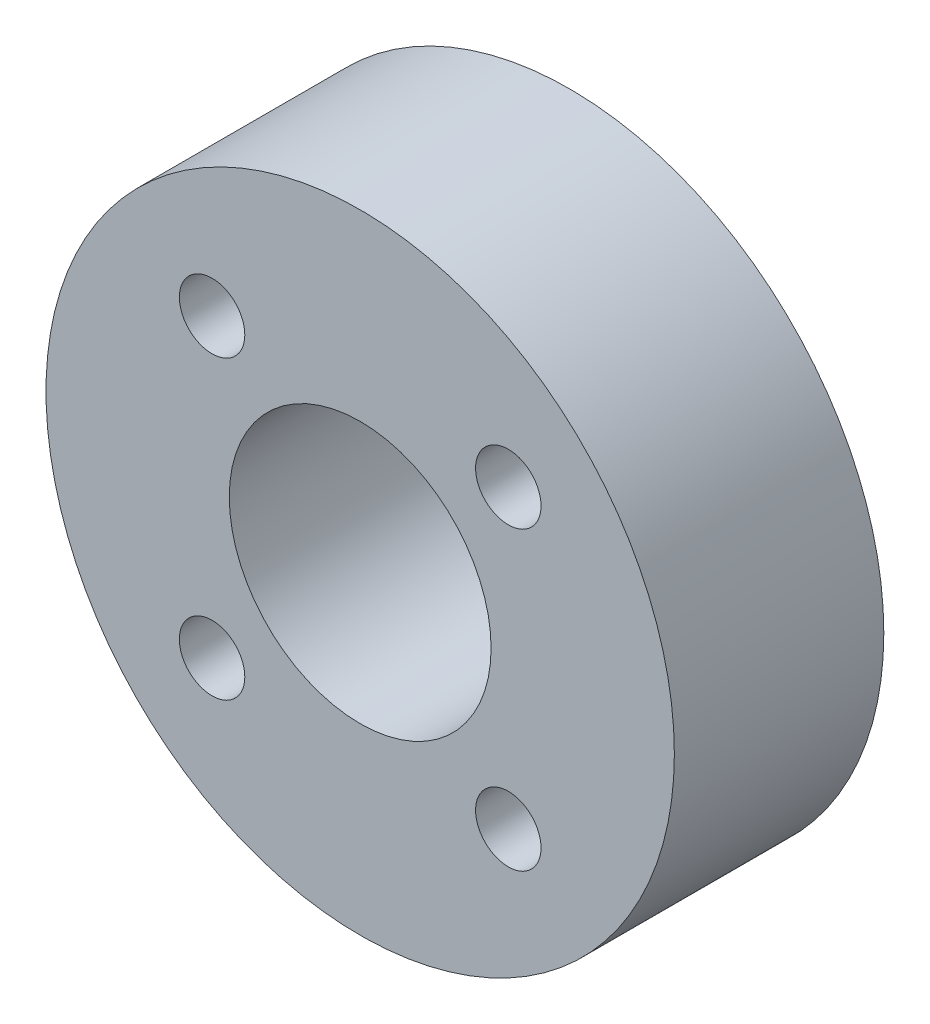
from build123d import *

# Parameters (mm, degrees)
D52_D29_5_8_2_R                    = 26
D52_D29_5_8_2_R_2                  = 14.75
D52_D29_5_8_DEPTH                  = 8
D10_D24_8_2_R                      = 12
D10_D24_8_2_R_2                    = 5
D10_D24_8_DEPTH                    = 8
F_6XD3_4_D6_5_3_3_PCD42_AT_2_COUNT = 2
F_6XD3_4_D6_5_3_3_PCD42_AT_2_PITCH = 21
F_6XD3_4_D6_5_3_3_PCD42_AT_3_COUNT = 2
F_6XD3_4_D6_5_3_3_PCD42_AT_3_PITCH = 36.373066959
F_6XD3_4_D6_5_3_3_PCD42_AT_4_COUNT = 2
F_6XD3_4_D6_5_3_3_PCD42_AT_4_PITCH = 42
F_6XD3_4_D6_5_3_3_PCD42_AT_5_COUNT = 2
F_6XD3_4_D6_5_3_3_PCD42_AT_5_PITCH = 36.373066959
F_6XD3_4_D6_5_3_3_PCD42_AT_6_COUNT = 2
F_6XD3_4_D6_5_3_3_PCD42_AT_6_PITCH = 21
SKETCH_6_W                         = 1.25
SKETCH_6_H                         = 8
F_4XM3X0_5_PCD16_AT_2_COUNT        = 2
F_4XM3X0_5_PCD16_AT_2_PITCH        = 11.313708499
F_4XM3X0_5_PCD16_AT_3_COUNT        = 2
F_4XM3X0_5_PCD16_AT_3_PITCH        = 16
F_4XM3X0_5_PCD16_AT_4_COUNT        = 2
F_4XM3X0_5_PCD16_AT_4_PITCH        = 11.313708499
EXTRUDE_START                      = 7.25
SKETCH_2072_R                      = 14.7
SKETCH_2072_R_2                    = 12.08
EXTRUDE_2083_DEPTH                 = 0.55
EXTRUDE_START_2                    = 0.2
SKETCH_2120_R                      = 14.7
SKETCH_2120_R_2                    = 12.08
EXTRUDE_2131_DEPTH                 = 0.55


with BuildPart() as part:
    # D52__D29.5__8 2 → D52__D29.5__8 (new body)
    with BuildSketch(Plane.XY):
        Circle(D52_D29_5_8_2_R)
        Circle(D52_D29_5_8_2_R_2, mode=Mode.SUBTRACT)
    extrude(amount=D52_D29_5_8_DEPTH)

    # 草图4 → 外圈_6xD3.4通孔_D6.5沉孔深3.3_PCD42 (revolve, cut)
    with BuildSketch(Plane(origin=(18.186533479, 10.5, 8), x_dir=(0, -1, 0), z_dir=(1, 0, 0))):
        Polygon((0, 0), (0, 8), (1.7, 8), (1.7, 3.3), (3.25, 3.3), (3.25, 0), align=None)
    f_6xd3_4_d6_5_3_3_pcd42 = revolve(axis=Axis((18.186533479, 10.5, 14.35), (0, 0, -1)), mode=Mode.SUBTRACT)

    # 外圈_6xD3.4通孔_D6.5沉孔深3.3_PCD42 at 2: 外圈_6xD3.4通孔_D6.5沉孔深3.3_PCD42 ×2
    with Locations(*[(0, -i * F_6XD3_4_D6_5_3_3_PCD42_AT_2_PITCH, 0) for i in range(1, F_6XD3_4_D6_5_3_3_PCD42_AT_2_COUNT)]):
        add(f_6xd3_4_d6_5_3_3_pcd42, mode=Mode.SUBTRACT)

    # 外圈_6xD3.4通孔_D6.5沉孔深3.3_PCD42 at 3: 外圈_6xD3.4通孔_D6.5沉孔深3.3_PCD42 ×2
    with Locations(*[Vector(-0.5000000000000001, -0.8660254037844386, 0) * (i * F_6XD3_4_D6_5_3_3_PCD42_AT_3_PITCH) for i in range(1, F_6XD3_4_D6_5_3_3_PCD42_AT_3_COUNT)]):
        add(f_6xd3_4_d6_5_3_3_pcd42, mode=Mode.SUBTRACT)

    # 外圈_6xD3.4通孔_D6.5沉孔深3.3_PCD42 at 4: 外圈_6xD3.4通孔_D6.5沉孔深3.3_PCD42 ×2
    with Locations(*[Vector(-0.8660254037844387, -0.49999999999999983, 0) * (i * F_6XD3_4_D6_5_3_3_PCD42_AT_4_PITCH) for i in range(1, F_6XD3_4_D6_5_3_3_PCD42_AT_4_COUNT)]):
        add(f_6xd3_4_d6_5_3_3_pcd42, mode=Mode.SUBTRACT)

    # 外圈_6xD3.4通孔_D6.5沉孔深3.3_PCD42 at 5: 外圈_6xD3.4通孔_D6.5沉孔深3.3_PCD42 ×2
    with Locations(*[(-i * F_6XD3_4_D6_5_3_3_PCD42_AT_5_PITCH, 0, 0) for i in range(1, F_6XD3_4_D6_5_3_3_PCD42_AT_5_COUNT)]):
        add(f_6xd3_4_d6_5_3_3_pcd42, mode=Mode.SUBTRACT)

    # 外圈_6xD3.4通孔_D6.5沉孔深3.3_PCD42 at 6: 外圈_6xD3.4通孔_D6.5沉孔深3.3_PCD42 ×2
    with Locations(*[Vector(-0.8660254037844387, 0.5, 0) * (i * F_6XD3_4_D6_5_3_3_PCD42_AT_6_PITCH) for i in range(1, F_6XD3_4_D6_5_3_3_PCD42_AT_6_COUNT)]):
        add(f_6xd3_4_d6_5_3_3_pcd42, mode=Mode.SUBTRACT)


with BuildPart() as body_2:
    # D10__D24__8 2 → D10__D24__8 (new body)
    with BuildSketch(Plane.XY):
        Circle(D10_D24_8_2_R)
        Circle(D10_D24_8_2_R_2, mode=Mode.SUBTRACT)
    extrude(amount=D10_D24_8_DEPTH)

    # 草图6 → 内圈_4xM3x0.5通螺纹_PCD16 (revolve, cut)
    with BuildSketch(Plane(origin=(5.656854249, -5.656854249, 8), x_dir=(0, -1, 0), z_dir=(1, 0, 0))):
        with Locations((0.625, 4)):
            Rectangle(SKETCH_6_W, SKETCH_6_H)
    f_4xm3x0_5_pcd16 = revolve(axis=Axis((5.656854249, -5.656854249, 14.35), (0, 0, -1)), mode=Mode.SUBTRACT)

    # 内圈_4xM3x0.5通螺纹_PCD16 at 2: 内圈_4xM3x0.5通螺纹_PCD16 ×2
    with Locations(*[(-i * F_4XM3X0_5_PCD16_AT_2_PITCH, 0, 0) for i in range(1, F_4XM3X0_5_PCD16_AT_2_COUNT)]):
        add(f_4xm3x0_5_pcd16, mode=Mode.SUBTRACT)

    # 内圈_4xM3x0.5通螺纹_PCD16 at 3: 内圈_4xM3x0.5通螺纹_PCD16 ×2
    with Locations(*[Vector(-0.7071067811865475, 0.7071067811865477, 0) * (i * F_4XM3X0_5_PCD16_AT_3_PITCH) for i in range(1, F_4XM3X0_5_PCD16_AT_3_COUNT)]):
        add(f_4xm3x0_5_pcd16, mode=Mode.SUBTRACT)

    # 内圈_4xM3x0.5通螺纹_PCD16 at 4: 内圈_4xM3x0.5通螺纹_PCD16 ×2
    with Locations(*[(0, i * F_4XM3X0_5_PCD16_AT_4_PITCH, 0) for i in range(1, F_4XM3X0_5_PCD16_AT_4_COUNT)]):
        add(f_4xm3x0_5_pcd16, mode=Mode.SUBTRACT)


with BuildPart() as body_3:
    # Sketch 2072 → Extrude 2083 (new body)
    with BuildSketch(Plane.XY.offset(EXTRUDE_START)):
        Circle(SKETCH_2072_R)
        Circle(SKETCH_2072_R_2, mode=Mode.SUBTRACT)
    extrude(amount=EXTRUDE_2083_DEPTH)


with BuildPart() as body_4:
    # Sketch 2120 → Extrude 2131 (new body)
    with BuildSketch(Plane.XY.offset(EXTRUDE_START_2)):
        Circle(SKETCH_2120_R)
        Circle(SKETCH_2120_R_2, mode=Mode.SUBTRACT)
    extrude(amount=EXTRUDE_2131_DEPTH)


solid = body_2.part
